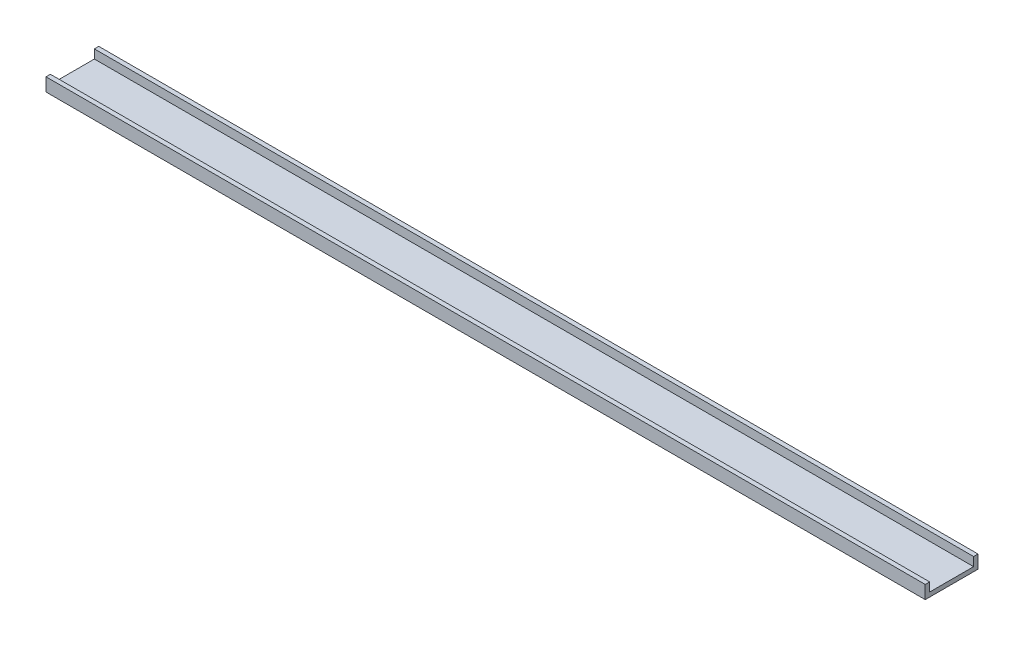
from build123d import *

# Parameters (mm, degrees)
SKETCH_1_W          = 1000
SKETCH_1_H          = 60
EXTRUDE_1_DEPTH     = 15
SKETCH_2_W          = 1000
SKETCH_2_H          = 50
CUT_EXTRUDE_1_DEPTH = 10
SCALE_1_SCALE       = 1.7


with BuildPart() as part:
    # 草图1 → 凸台-拉伸1 (new body)
    with BuildSketch(Plane(origin=(0, 0, 0), x_dir=(1, 0, 0), z_dir=(0, 1, 0))):
        with Locations((244.680851064, 54.219858156)):
            Rectangle(SKETCH_1_W, SKETCH_1_H)
    extrude(amount=EXTRUDE_1_DEPTH)

    # 草图2 → 切除-拉伸1 (cut)
    with BuildSketch(Plane(origin=(0, 15, 0), x_dir=(1, 0, 0), z_dir=(0, 1, 0))):
        with Locations((244.680851064, 54.219858156)):
            Rectangle(SKETCH_2_W, SKETCH_2_H)
    extrude(amount=-CUT_EXTRUDE_1_DEPTH, mode=Mode.SUBTRACT)


with BuildPart() as part_1:
    # 缩放比例1: scaled about (0, 0, 0)
    add(part.part.scale(SCALE_1_SCALE))


solid = part_1.part
